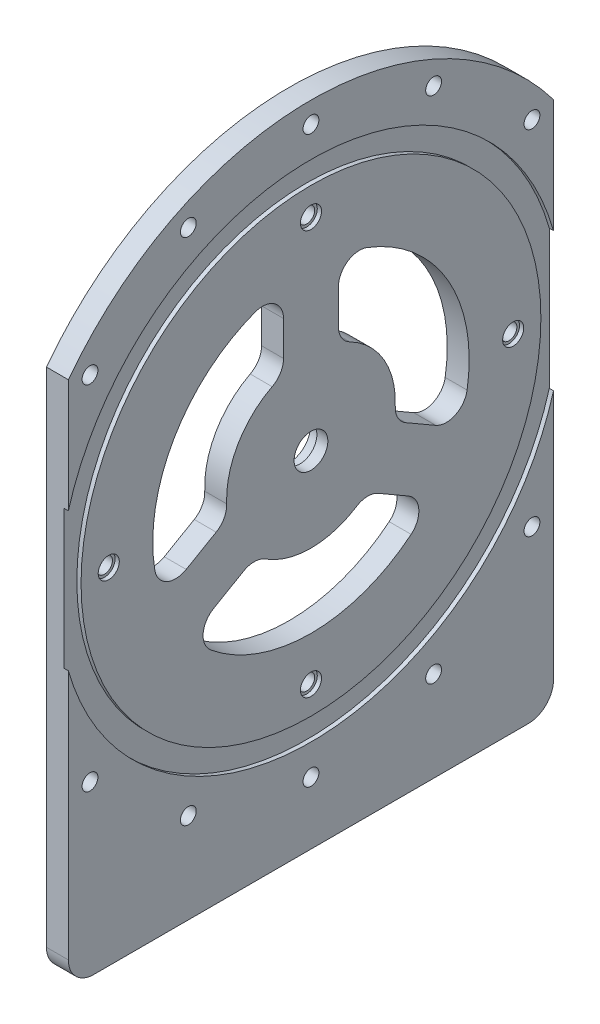
from build123d import *

# Parameters (mm, degrees)
SKETCH1_R           = 5.08
BOSS_EXTRUDE1_DEPTH = 6.604
SKETCH2_R           = 6.477
CUT_EXTRUDE1_DEPTH  = 3.302
SKETCH3_R           = 75.946
SKETCH3_R_2         = 69.215
CUT_EXTRUDE2_DEPTH  = 1.27
SKETCH4_R           = 2.38125
CUT_EXTRUDE3_DEPTH  = 139.530727768
SKETCH5_R           = 3.77825
CUT_EXTRUDE4_DEPTH  = 1.27
CUT_EXTRUDE5_DEPTH  = 139.530727768
SKETCH10_R          = 57.15
SKETCH10_R_2        = 50.8
CUT_EXTRUDE6_DEPTH  = 1.27
SKETCH12_R          = 2.38125
CUT_EXTRUDE7_DEPTH  = 139.530727768
SKETCH15_R          = 3.175
CUT_EXTRUDE11_DEPTH = 1.27
SKETCH16_W          = 32.206831535
SKETCH16_H          = 125.02997604
SKETCH16_W_2        = 34.902507441
CUT_EXTRUDE12_DEPTH = 139.530727768


with BuildPart() as part:
    # Sketch1 → Boss-Extrude1 (new body)
    with BuildSketch(Plane(origin=(0, 0, 0), x_dir=(0, 0, -1), z_dir=(1, 0, 0))):
        with BuildLine():
            Line((-65.405, -103.855072673), (65.405, -103.855072673))
            ThreePointArc((65.405, -103.855072673), (70.793153673, -101.623226346), (73.025, -96.235072673))
            Line((73.025, -96.235072673), (73.025, -69.997049759))
            ThreePointArc((73.025, -69.997049759), (74.696702219, -57.072253546), (79.601785714, -44.998103417))
            ThreePointArc((79.601785714, -44.998103417), (0, 91.44), (-79.601785714, -44.998103417))
            ThreePointArc((-79.601785714, -44.998103417), (-74.696702219, -57.072253546), (-73.025, -69.997049759))
            Line((-73.025, -69.997049759), (-73.025, -96.235072673))
            ThreePointArc((-73.025, -96.235072673), (-70.793153673, -101.623226346), (-65.405, -103.855072673))
        make_face()
        with Locations(Location((0, 0, 0), (0, 0, 180))):
            Circle(SKETCH1_R, mode=Mode.SUBTRACT)
    extrude(amount=BOSS_EXTRUDE1_DEPTH)

    # Sketch2 → Cut-Extrude1 (cut)
    with BuildSketch(Plane(origin=(0, 0, 0), x_dir=(0, 0, -1), z_dir=(1, 0, 0))):
        with Locations(Location((0, 0, 0), (0, 0, 180))):
            Circle(SKETCH2_R)
    extrude(amount=CUT_EXTRUDE1_DEPTH, mode=Mode.SUBTRACT)

    # Sketch3 → Cut-Extrude2 (cut)
    with BuildSketch(Plane(origin=(6.604, 0, 0), x_dir=(0, 0, -1), z_dir=(1, 0, 0))):
        Circle(SKETCH3_R)
        Circle(SKETCH3_R_2, mode=Mode.SUBTRACT)
    extrude(amount=-CUT_EXTRUDE2_DEPTH, mode=Mode.SUBTRACT)

    # Sketch4 → Cut-Extrude3 (cut, through all)
    with BuildSketch(Plane.ZY):
        with Locations((-66.526040843, 53.05274724)):
            Circle(SKETCH4_R)
        with Locations((0, 85.09)):
            Circle(SKETCH4_R)
        with Locations((-36.919167362, 76.66344097)):
            Circle(SKETCH4_R)
        with Locations((36.919167362, 76.66344097)):
            Circle(SKETCH4_R)
        with Locations((66.526040843, 53.05274724)):
            Circle(SKETCH4_R)
        with Locations((82.956616048, 18.93430627)):
            Circle(SKETCH4_R)
        with Locations((82.956616048, -18.93430627)):
            Circle(SKETCH4_R)
        with Locations((66.526040843, -53.05274724)):
            Circle(SKETCH4_R)
        with Locations((36.919167362, -76.66344097)):
            Circle(SKETCH4_R)
        with Locations((0, -85.09)):
            Circle(SKETCH4_R)
        with Locations((-36.919167361, -76.66344097)):
            Circle(SKETCH4_R)
        with Locations((-66.526040843, -53.05274724)):
            Circle(SKETCH4_R)
        with Locations((-82.956616048, -18.93430627)):
            Circle(SKETCH4_R)
        with Locations((-82.956616048, 18.93430627)):
            Circle(SKETCH4_R)
    extrude(amount=-CUT_EXTRUDE3_DEPTH, mode=Mode.SUBTRACT)

    # Sketch5 → Cut-Extrude4 (cut)
    with BuildSketch(Plane.ZY):
        with Locations((0, 85.09)):
            Circle(SKETCH5_R)
        with Locations((-82.956616048, 18.93430627)):
            Circle(SKETCH5_R)
        with Locations((-66.526040843, 53.05274724)):
            Circle(SKETCH5_R)
        with Locations((36.919167362, 76.66344097)):
            Circle(SKETCH5_R)
        with Locations((-36.919167362, 76.66344097)):
            Circle(SKETCH5_R)
        with Locations((66.526040843, 53.05274724)):
            Circle(SKETCH5_R)
        with Locations((82.956616048, 18.93430627)):
            Circle(SKETCH5_R)
        with Locations((82.956616048, -18.93430627)):
            Circle(SKETCH5_R)
        with Locations((66.526040843, -53.05274724)):
            Circle(SKETCH5_R)
        with Locations((36.919167362, -76.66344097)):
            Circle(SKETCH5_R)
        with Locations((0, -85.09)):
            Circle(SKETCH5_R)
        with Locations((-36.919167362, -76.66344097)):
            Circle(SKETCH5_R)
        with Locations((-66.526040843, -53.05274724)):
            Circle(SKETCH5_R)
        with Locations((-82.956616048, -18.93430627)):
            Circle(SKETCH5_R)
    extrude(amount=-CUT_EXTRUDE4_DEPTH, mode=Mode.SUBTRACT)

    # Sketch9 → Cut-Extrude5 (cut, through all)
    with BuildSketch(Plane.ZY):
        with BuildLine():
            Line((-8.255, 38.60465775), (-8.255, 28.191425558))
            ThreePointArc((-8.255, 28.191425558), (-9.179557622, 24.89186877), (-11.684, 22.553140447))
            ThreePointArc((-11.684, 22.553140447), (-21.997045256, 12.7), (-25.373592562, -1.157929405))
            ThreePointArc((-25.373592562, -1.157929405), (-26.146769513, -4.496204289), (-28.541990702, -6.946673071))
            Line((-28.541990702, -6.946673071), (-37.560114316, -12.153289167))
            ThreePointArc((-37.560114316, -12.153289167), (-43.454984563, -12.392041955), (-47.00205498, -7.677724445))
            ThreePointArc((-47.00205498, -7.677724445), (-41.244459855, 23.8125), (-16.851923077, 44.543835865))
            ThreePointArc((-16.851923077, 44.543835865), (-10.995669144, 43.82914153), (-8.255, 38.60465775))
        make_face()
        with BuildLine():
            Line((8.255, 38.60465775), (8.255, 28.191425558))
            ThreePointArc((8.255, 28.191425558), (9.179557622, 24.89186877), (11.684, 22.553140447))
            ThreePointArc((11.684, 22.553140447), (21.997045256, 12.7), (25.373592562, -1.157929405))
            ThreePointArc((25.373592562, -1.157929405), (26.146769513, -4.496204289), (28.541990702, -6.946673071))
            Line((28.541990702, -6.946673071), (37.560114316, -12.153289167))
            ThreePointArc((37.560114316, -12.153289167), (43.454984563, -12.392041955), (47.00205498, -7.677724445))
            ThreePointArc((47.00205498, -7.677724445), (41.244459855, 23.8125), (16.851923077, 44.543835865))
            ThreePointArc((16.851923077, 44.543835865), (10.995669144, 43.82914153), (8.255, 38.60465775))
        make_face()
        with BuildLine():
            Line((29.305114316, -26.451368583), (20.286990702, -21.244752487))
            ThreePointArc((20.286990702, -21.244752487), (16.967211891, -20.395664481), (13.689592562, -21.395211041))
            ThreePointArc((13.689592562, -21.395211041), (0, -25.4), (-13.689592562, -21.395211041))
            ThreePointArc((-13.689592562, -21.395211041), (-16.967211891, -20.395664481), (-20.286990702, -21.244752487))
            Line((-20.286990702, -21.244752487), (-29.305114316, -26.451368583))
            ThreePointArc((-29.305114316, -26.451368583), (-32.459315419, -31.437099575), (-30.150131903, -36.86611142))
            ThreePointArc((-30.150131903, -36.86611142), (0, -47.625), (30.150131903, -36.86611142))
            ThreePointArc((30.150131903, -36.86611142), (32.459315419, -31.437099575), (29.305114316, -26.451368583))
        make_face()
    extrude(amount=-CUT_EXTRUDE5_DEPTH, mode=Mode.SUBTRACT)

    # Sketch10 → Cut-Extrude6 (cut)
    with BuildSketch(Plane.ZY):
        Circle(SKETCH10_R)
        Circle(SKETCH10_R_2, mode=Mode.SUBTRACT)
    extrude(amount=-CUT_EXTRUDE6_DEPTH, mode=Mode.SUBTRACT)

    # Sketch12 → Cut-Extrude7 (cut, through all)
    with BuildSketch(Plane.ZY):
        with Locations((0, 60.874333344)):
            Circle(SKETCH12_R)
        with Locations((60.874333344, 0)):
            Circle(SKETCH12_R)
        with Locations((0, -60.874333344)):
            Circle(SKETCH12_R)
        with Locations((-60.874333344, 0)):
            Circle(SKETCH12_R)
    extrude(amount=-CUT_EXTRUDE7_DEPTH, mode=Mode.SUBTRACT)

    # Sketch15 → Cut-Extrude11 (cut)
    with BuildSketch(Plane(origin=(6.604, 0, 0), x_dir=(0, 0, -1), z_dir=(1, 0, 0))):
        with Locations((0, 60.874333344)):
            Circle(SKETCH15_R)
        with Locations((60.874333344, 0)):
            Circle(SKETCH15_R)
        with Locations((0, -60.874333344)):
            Circle(SKETCH15_R)
        with Locations((-60.874333344, 0)):
            Circle(SKETCH15_R)
    extrude(amount=-CUT_EXTRUDE11_DEPTH, mode=Mode.SUBTRACT)

    # Sketch16 → Cut-Extrude12 (cut, through all)
    with BuildSketch(Plane.ZY):
        with Locations((-89.128415768, -7.482061739)):
            Rectangle(SKETCH16_W, SKETCH16_H)
        with Locations((90.476253721, -7.482061739)):
            Rectangle(SKETCH16_W_2, SKETCH16_H)
    extrude(amount=-CUT_EXTRUDE12_DEPTH, mode=Mode.SUBTRACT)


solid = part.part
